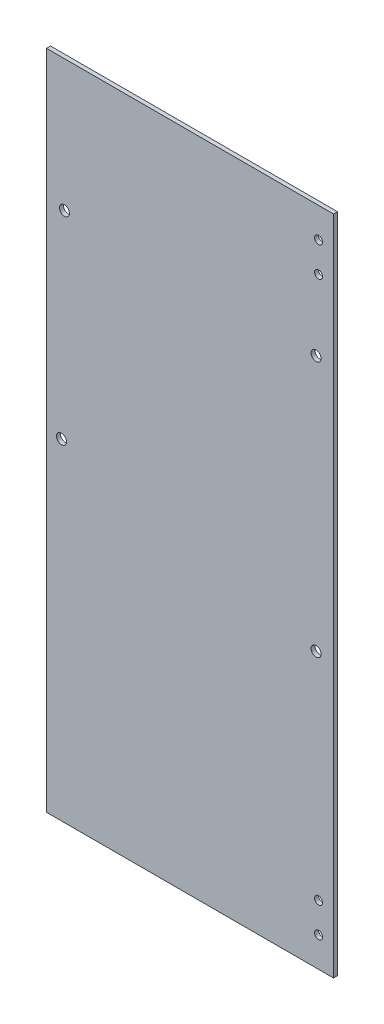
from build123d import *

# Parameters (mm, degrees)
SKETCH_1_W          = 144
SKETCH_1_H          = 332
EXTRUDE_1_DEPTH     = 2
SKETCH_2_R          = 2.5
CUT_EXTRUDE_1_DEPTH = 2
SKETCH_4_R          = 2
SKETCH_4_R_2        = 2.5
CUT_EXTRUDE_2_DEPTH = 10


with BuildPart() as part:
    # 草图1 → 凸台-拉伸1 (new body)
    with BuildSketch(Plane.XY):
        with Locations((72, -166)):
            Rectangle(SKETCH_1_W, SKETCH_1_H)
    extrude(amount=EXTRUDE_1_DEPTH)

    # 草图2 → 切除-拉伸1 (cut)
    with BuildSketch(Plane.XY.offset(2)):
        with Locations((9, -66)):
            Circle(SKETCH_2_R)
        with Locations(Location((135.26, -66, 0), (0, 0, 180))):
            Circle(SKETCH_2_R)
        with Locations((135.26, -194.4)):
            Circle(SKETCH_2_R)
    extrude(amount=-CUT_EXTRUDE_1_DEPTH, mode=Mode.SUBTRACT)

    # 草图4 → 切除-拉伸2 (cut)
    with BuildSketch(Plane(origin=(0, 0, 0), x_dir=(-1, 0, 0), z_dir=(0, 0, -1))):
        with Locations((-136.5, -15)):
            Circle(SKETCH_4_R)
        with Locations((-136.5, -30)):
            Circle(SKETCH_4_R)
        with Locations(Location((-136.5, -302, 0), (0, 0, 180))):
            Circle(SKETCH_4_R)
        with Locations(Location((-136.5, -317, 0), (0, 0, 180))):
            Circle(SKETCH_4_R)
        with Locations((-7.5, -166)):
            Circle(SKETCH_4_R_2)
    extrude(amount=-CUT_EXTRUDE_2_DEPTH, mode=Mode.SUBTRACT)


solid = part.part
